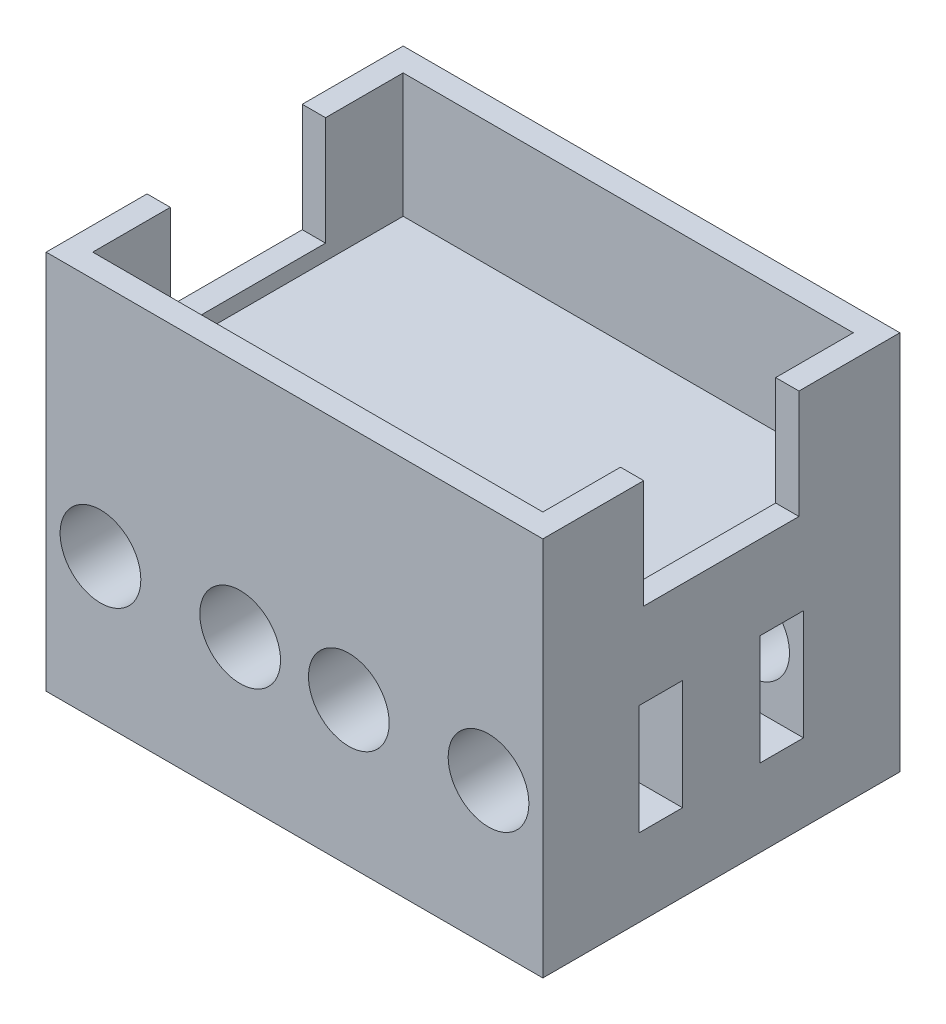
from build123d import *

# Parameters (mm, degrees)
SKETCH4_W           = 32
SKETCH4_H           = 23
BOSS_EXTRUDE3_DEPTH = 9.5
SKETCH5_W           = 29
SKETCH5_H           = 20
CUT_EXTRUDE2_DEPTH  = 8
SKETCH7_W           = 10
SKETCH7_H           = 7
CUT_EXTRUDE4_DEPTH  = 36.305806888
SKETCH8_W           = 32
SKETCH8_H           = 23
BOSS_EXTRUDE4_DEPTH = 10
SKETCH12_R          = 2.6
CUT_EXTRUDE5_DEPTH  = 7
CIRPATTERN1_COUNT   = 2
CIRPATTERN1_ANGLE   = 180
SKETCH13_W          = 15
SKETCH13_H          = 2.791622882
CUT_EXTRUDE6_DEPTH  = 7.1
SKETCH14_W          = 32
SKETCH14_H          = 23
BOSS_EXTRUDE5_DEPTH = 5


with BuildPart() as part:
    # Sketch4 → Boss-Extrude3 (new body)
    with BuildSketch(Plane(origin=(0, 0, 0), x_dir=(1, 0, 0), z_dir=(0, 1, 0))):
        Rectangle(SKETCH4_W, SKETCH4_H)
    extrude(amount=BOSS_EXTRUDE3_DEPTH)

    # Sketch5 → Cut-Extrude2 (cut)
    with BuildSketch(Plane(origin=(0, 9.5, 0), x_dir=(1, 0, 0), z_dir=(0, 1, 0))):
        Rectangle(SKETCH5_W, SKETCH5_H)
    extrude(amount=-CUT_EXTRUDE2_DEPTH, mode=Mode.SUBTRACT)

    # Sketch7 → Cut-Extrude4 (cut, through all)
    with BuildSketch(Plane(origin=(16, 0, 0), x_dir=(0, 0, -1), z_dir=(1, 0, 0))):
        with Locations((0, 6)):
            Rectangle(SKETCH7_W, SKETCH7_H)
    extrude(amount=-CUT_EXTRUDE4_DEPTH, mode=Mode.SUBTRACT)

    # Sketch8 → Boss-Extrude4 (add)
    with BuildSketch(Plane(origin=(0, 0, 0), x_dir=(-1, 0, 0), z_dir=(0, -1, 0))):
        Rectangle(SKETCH8_W, SKETCH8_H)
    extrude(amount=BOSS_EXTRUDE4_DEPTH)

    # Sketch12 → Cut-Extrude5 (cut)
    with BuildSketch(Plane(origin=(0, 0, -11.5), x_dir=(-1, 0, 0), z_dir=(0, 0, -1))):
        with Locations((-12.5, -5.726898225)):
            Circle(SKETCH12_R)
        with Locations(Location((-3.5, -5.726898225, 0), (0, 0, 180))):
            Circle(SKETCH12_R)
        with Locations((3.5, -5.726898225)):
            Circle(SKETCH12_R)
        with Locations(Location((12.5, -5.726898225, 0), (0, 0, 180))):
            Circle(SKETCH12_R)
    cut_extrude5 = extrude(amount=-CUT_EXTRUDE5_DEPTH, mode=Mode.SUBTRACT)

    # CirPattern1: Cut-Extrude5 ×2 about axis
    cirpattern1_axis = Axis((0, 1.5, 0), (0, -1, 0))
    for i in range(1, CIRPATTERN1_COUNT):
        add(cut_extrude5.rotate(cirpattern1_axis, i * CIRPATTERN1_ANGLE / (CIRPATTERN1_COUNT - 1)), mode=Mode.SUBTRACT)

    # Sketch13 → Cut-Extrude6 (cut)
    with BuildSketch(Plane(origin=(0, -10, 0), x_dir=(-1, 0, 0), z_dir=(0, -1, 0))):
        with Locations((8.5, 3.895811441)):
            Rectangle(SKETCH13_W, SKETCH13_H)
        with Locations((-8.5, 3.895811441)):
            Rectangle(SKETCH13_W, SKETCH13_H)
        with Locations((-8.5, -3.895811441)):
            Rectangle(SKETCH13_W, SKETCH13_H)
        with Locations((8.5, -3.895811441)):
            Rectangle(SKETCH13_W, SKETCH13_H)
    extrude(amount=-CUT_EXTRUDE6_DEPTH, mode=Mode.SUBTRACT)

    # Sketch14 → Boss-Extrude5 (add)
    with BuildSketch(Plane(origin=(0, -10, 0), x_dir=(-1, 0, 0), z_dir=(0, -1, 0))):
        Rectangle(SKETCH14_W, SKETCH14_H)
    extrude(amount=BOSS_EXTRUDE5_DEPTH)


solid = part.part
